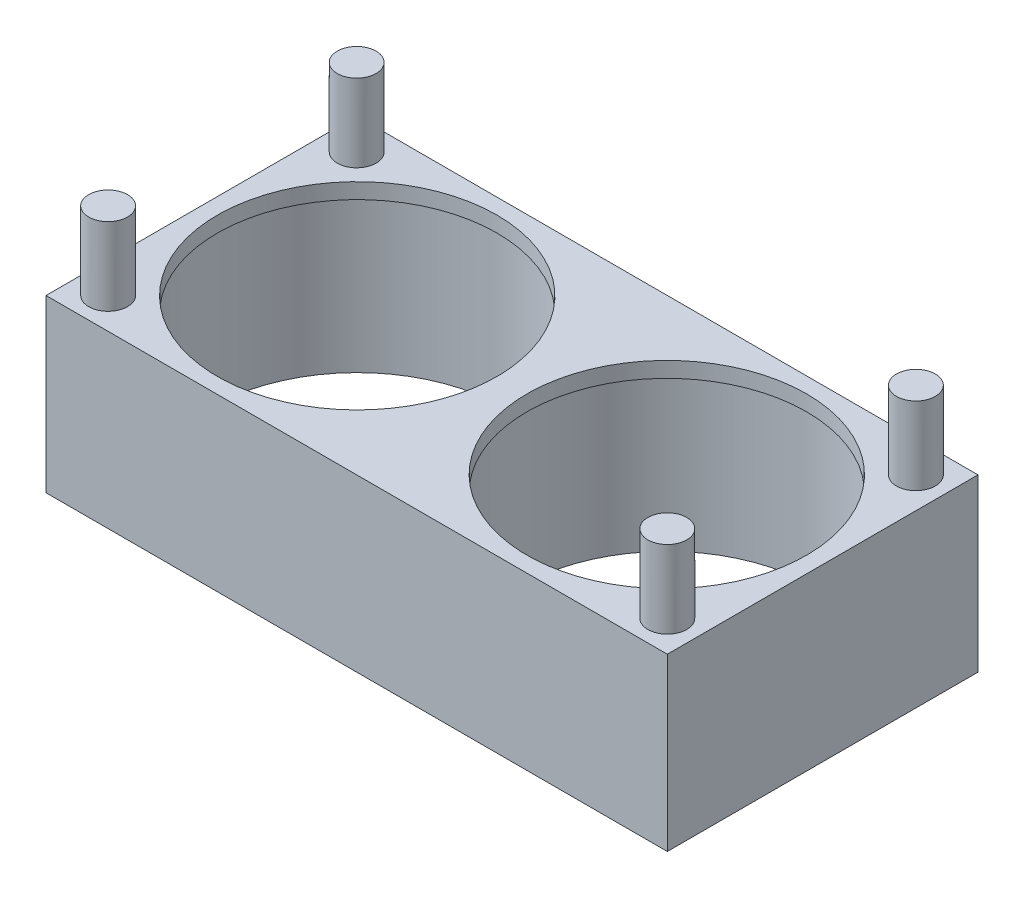
from build123d import *

# Parameters (mm, degrees)
SKETCH1_W           = 80
SKETCH1_H           = 40
BOSS_EXTRUDE1_DEPTH = 22
SKETCH2_R           = 19
CUT_EXTRUDE1_DEPTH  = 20
SKETCH3_R           = 17.999999941
CUT_EXTRUDE2_DEPTH  = 92.651513899
SKETCH4_R           = 2.5
BOSS_EXTRUDE2_DEPTH = 10


with BuildPart() as part:
    # Sketch1 → Boss-Extrude1 (new body)
    with BuildSketch(Plane(origin=(0, 0, 0), x_dir=(1, 0, 0), z_dir=(0, 1, 0))):
        with Locations((40, 20)):
            Rectangle(SKETCH1_W, SKETCH1_H)
    extrude(amount=BOSS_EXTRUDE1_DEPTH)

    # Sketch2 → Cut-Extrude1 (cut)
    with BuildSketch(Plane.XZ):
        with Locations(Location((20.07, -20, 0), (0, 0, 270))):
            Circle(SKETCH2_R)
        with Locations(Location((59.93, -20, 0), (0, 0, 270))):
            Circle(SKETCH2_R)
    extrude(amount=-CUT_EXTRUDE1_DEPTH, mode=Mode.SUBTRACT)

    # Sketch3 → Cut-Extrude2 (cut, through all)
    with BuildSketch(Plane.XZ.offset(-20)):
        with Locations(Location((20.07, -20, 0), (0, 0, 270))):
            Circle(SKETCH3_R)
        with Locations(Location((59.93, -20, 0), (0, 0, 270))):
            Circle(SKETCH3_R)
    extrude(amount=-CUT_EXTRUDE2_DEPTH, mode=Mode.SUBTRACT)

    # Sketch4 → Boss-Extrude2 (add)
    with BuildSketch(Plane(origin=(0, 22, 0), x_dir=(1, 0, 0), z_dir=(0, 1, 0))):
        with Locations(Location((4, 36, 0), (0, 0, 90))):
            Circle(SKETCH4_R)
        with Locations(Location((76, 36, 0), (0, 0, 90))):
            Circle(SKETCH4_R)
        with Locations(Location((76, 4, 0), (0, 0, 90))):
            Circle(SKETCH4_R)
        with Locations(Location((4, 4, 0), (0, 0, 90))):
            Circle(SKETCH4_R)
    extrude(amount=BOSS_EXTRUDE2_DEPTH)


solid = part.part
